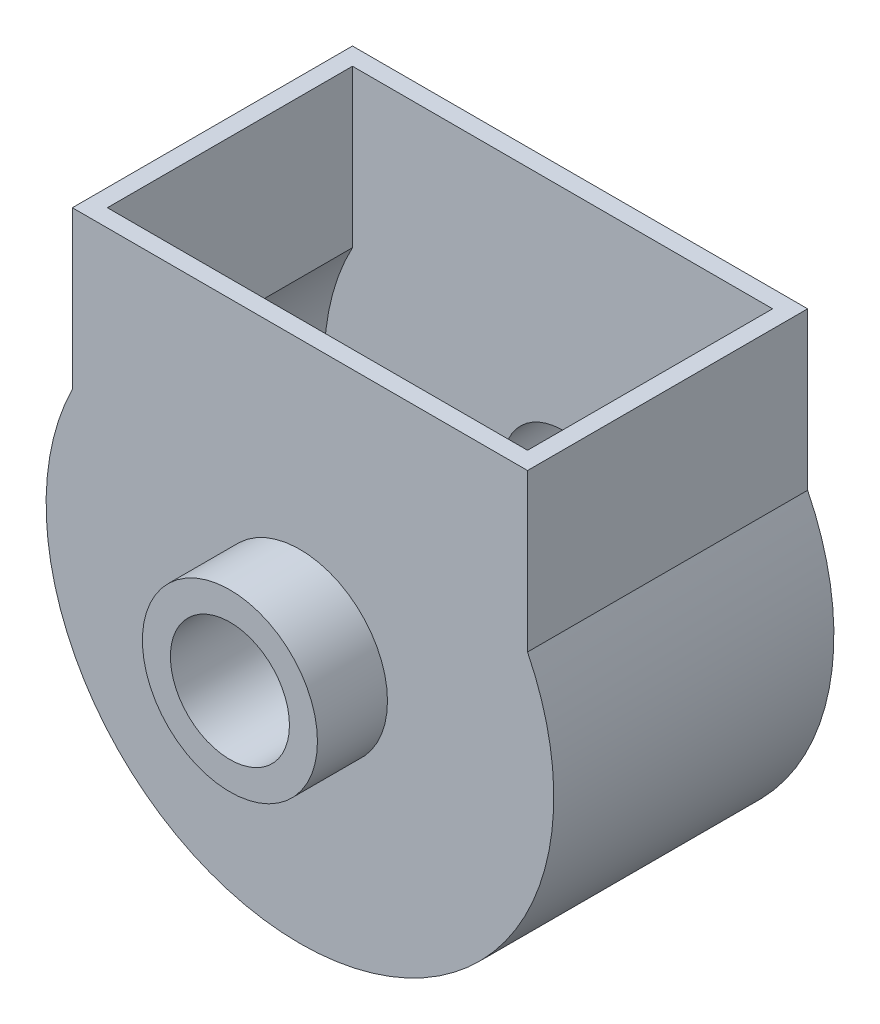
from build123d import *
from build123d.topology import SkipClean

# Parameters (mm, degrees)
BOSS_EXTRUDE1_DEPTH      = 20
BOSS_EXTRUDE1_DEPTH_BACK = 5
BOSS_EXTRUDE2_START      = -5
BOSS_EXTRUDE2_DEPTH      = 5
BOSS_EXTRUDE3_DEPTH      = 70


with BuildPart() as part:
    # Sketch1 → Boss-Extrude1 (new, two sides: drawn at the far end of the back side and taken through both)
    with BuildSketch(Plane.XY.offset(-BOSS_EXTRUDE1_DEPTH_BACK)):
        with BuildLine():
            Line((0, 25), (0, 17))
            ThreePointArc((0, 17), (-17, 0), (0, -17))
            Line((0, -17), (0, -25))
            ThreePointArc((0, -25), (-25, 0), (0, 25))
        make_face()
    extrude(amount=BOSS_EXTRUDE1_DEPTH + BOSS_EXTRUDE1_DEPTH_BACK)

    # Sketch2 → Boss-Extrude2 (add)
    with BuildSketch(Plane.XY.offset(BOSS_EXTRUDE2_START)):
        with BuildLine():
            Line((0, -25), (0, -72.5))
            ThreePointArc((0, -72.5), (-61.581037686, -38.262590053), (-65, 32.113081447))
            Line((-65, 32.113081447), (-65, 77))
            Line((-65, 77), (0, 77))
            Line((0, 77), (0, 25))
            Line((0, 25), (0, 17))
            ThreePointArc((0, 17), (-17, 0), (0, -17))
            Line((0, -17), (0, -25))
        make_face()
    extrude(amount=BOSS_EXTRUDE2_DEPTH)


with BuildPart() as body_2:
    # Mirror8: mirrored copy
    add(part.part.mirror(Plane.XY.offset(-40)))


with BuildPart() as part_1:
    add(part.part)

    add(body_2.part)  # Boss-Extrude3 merges body 2
    # Sketch3 → Boss-Extrude3 (add)
    with BuildSketch(Plane.XY.offset(-75)):
        with BuildLine():
            Line((-65, 32.113081447), (-65, 77))
            Line((-65, 77), (-60, 77))
            Line((-60, 77), (-60, 32.113081447))
            ThreePointArc((-60, 32.113081447), (-58.380864924, -34.970339014), (0, -68.053287944))
            Line((0, -68.053287944), (0, -72.5))
            ThreePointArc((0, -72.5), (-61.581037686, -38.262590053), (-65, 32.113081447))
        make_face()
    extrude(amount=BOSS_EXTRUDE3_DEPTH)

    # Mirror9: part across plane


with BuildPart() as part_2:
    with SkipClean():  # the faces are left unmerged after this step: merging them gives an invalid solid
        add(part_1.part)
        add(part_1.part.mirror(Plane(origin=(0, 0, 0), x_dir=(0, 0, 1), z_dir=(1, 0, 0))))


solid = part_2.part
